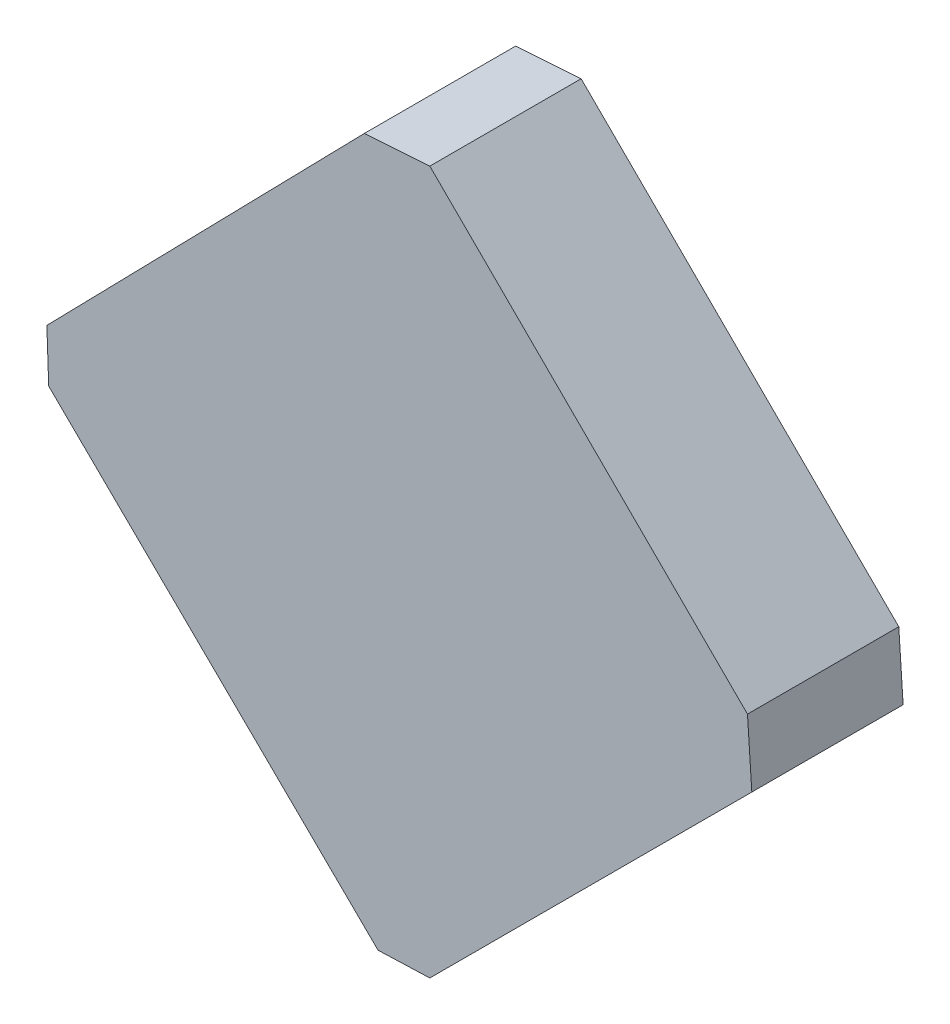
from build123d import *

# Parameters (mm, degrees)
BOSS_EXTRUDE1_DEPTH = 5


with BuildPart() as part:
    # Sketch1 → Boss-Extrude1 (new body)
    with BuildSketch(Plane.XY):
        Polygon((-11.646726132, 0.762997878), (-1.153516984, 11.503694399), (1.007168318, 11.646726132), (11.503694399, 1.214136586), (11.646726132, -0.946548716), (1.007168318, -11.58610653), (-0.702378276, -11.646726132), (-11.58610653, -0.946548716), align=None)
    extrude(amount=BOSS_EXTRUDE1_DEPTH)


solid = part.part
